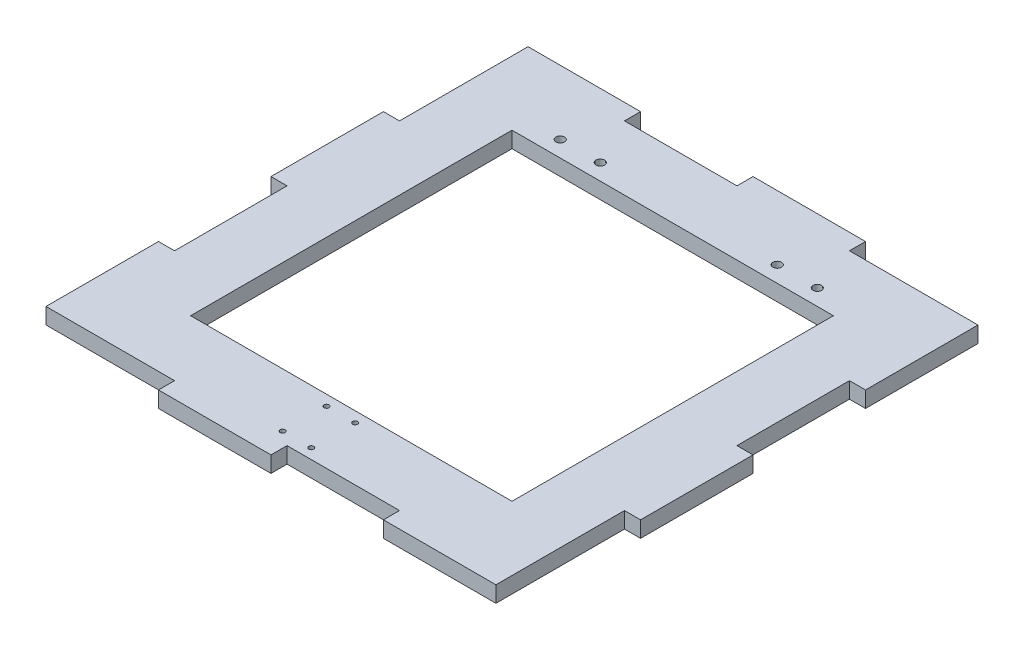
from build123d import *

# Parameters (mm, degrees)
SKETCH1_R           = 1.7018
SKETCH1_R_2         = 0.98425
SKETCH1_W           = 127
SKETCH1_H           = 127
BOSS_EXTRUDE1_DEPTH = 6.35


with BuildPart() as part:
    # Sketch1 → Boss-Extrude1 (new body)
    with BuildSketch(Plane(origin=(0, 0, 0), x_dir=(1, 0, 0), z_dir=(0, 1, 0))):
        Polygon((-155.3385836, 3.503957448), (-148.9885836, 3.503957448), (-148.9885836, -40.946042552), (-155.3385836, -40.946042552), (-155.3385836, -85.396042552), (-104.5385836, -85.396042552), (-104.5385836, -91.746042552), (-60.0885836, -91.746042552), (-60.0885836, -85.396042552), (-15.6385836, -85.396042552), (-15.6385836, -91.746042552), (28.8114164, -91.746042552), (28.8114164, -40.946042552), (35.1614164, -40.946042552), (35.1614164, 3.503957448), (28.8114164, 3.503957448), (28.8114164, 47.953957448), (35.1614164, 47.953957448), (35.1614164, 92.403957448), (-15.6385836, 92.403957448), (-15.6385836, 98.753957448), (-60.0885836, 98.753957448), (-60.0885836, 92.403957448), (-104.5385836, 92.403957448), (-104.5385836, 98.753957448), (-148.9885836, 98.753957448), (-148.9885836, 47.953957448), (-155.3385836, 47.953957448), align=None)
        with Locations(Location((-9.2885836, 73.353957448, 0), (0, 0, 270))):
            Circle(SKETCH1_R, mode=Mode.SUBTRACT)
        with Locations(Location((-65.889299947, -81.332042552, 0), (0, 0, 270))):
            Circle(SKETCH1_R_2, mode=Mode.SUBTRACT)
        with Locations(Location((-65.7464336, -64.124135606, 0), (0, 0, 270))):
            Circle(SKETCH1_R_2, mode=Mode.SUBTRACT)
        with Locations(Location((-54.573599947, -81.332042552, 0), (0, 0, 270))):
            Circle(SKETCH1_R_2, mode=Mode.SUBTRACT)
        with Locations(Location((-54.4307336, -64.124135606, 0), (0, 0, 270))):
            Circle(SKETCH1_R_2, mode=Mode.SUBTRACT)
        with Locations((-60.0885836, 3.503957448)):
            Rectangle(SKETCH1_W, SKETCH1_H, mode=Mode.SUBTRACT)
        with Locations(Location((-110.8885836, 73.353957448, 0), (0, 0, 270))):
            Circle(SKETCH1_R, mode=Mode.SUBTRACT)
        with Locations(Location((-95.0516836, 73.353957448, 0), (0, 0, 270))):
            Circle(SKETCH1_R, mode=Mode.SUBTRACT)
        with Locations(Location((-25.1254836, 73.353957448, 0), (0, 0, 270))):
            Circle(SKETCH1_R, mode=Mode.SUBTRACT)
    extrude(amount=BOSS_EXTRUDE1_DEPTH)


solid = part.part
